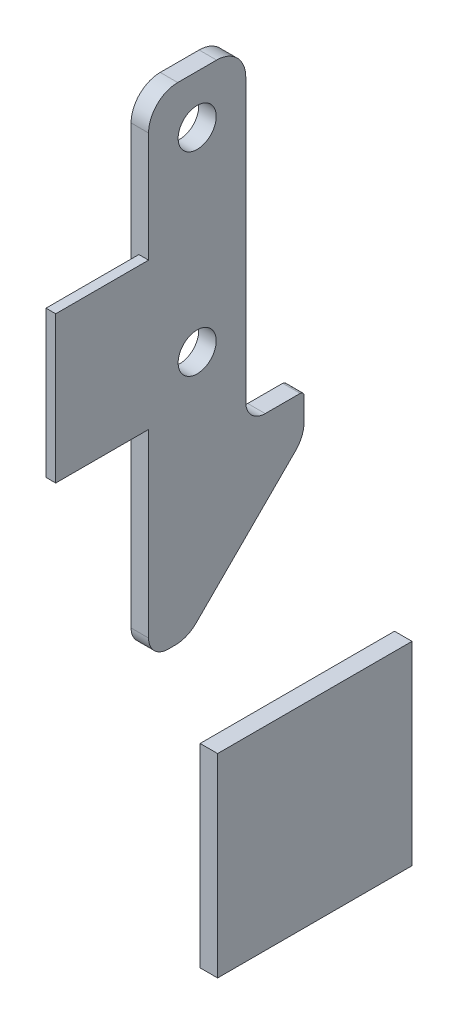
from build123d import *

# Parameters (mm, degrees)
SKETCH1_R           = 2.4892
BOSS_EXTRUDE1_DEPTH = 1.143
FILLET1_R           = 2.54
FILLET2_R           = 0.508
FILLET3_R           = 3.81
FILLET4_R           = 2.54
SKETCH4_W           = 25.4
SKETCH4_H           = 25.4
BOSS_EXTRUDE4_DEPTH = 2.286
SKETCH5_W           = 12.133155836
SKETCH5_H           = 19.15881217
BOSS_EXTRUDE5_DEPTH = 1.27


with BuildPart() as part:
    # Sketch1 → Boss-Extrude1 (new, symmetric)
    with BuildSketch(Plane(origin=(0, 0, 0), x_dir=(0, 0, -1), z_dir=(1, 0, 0))):
        Polygon((-6.35, -57.15), (-6.35, 6.35), (6.35, 6.35), (6.35, -36.83), (13.97, -36.83), (13.97, -41.91), (-1.27, -57.15), align=None)
        Circle(SKETCH1_R, mode=Mode.SUBTRACT)
        with Locations((0, -25.4)):
            Circle(SKETCH1_R, mode=Mode.SUBTRACT)
    extrude(amount=BOSS_EXTRUDE1_DEPTH, both=True)

    # Fillet1
    fillet1_edges = [part.edges().sort_by_distance(p)[0] for p in [
        (0, -36.83, -6.35),
    ]]
    fillet(fillet1_edges, radius=FILLET1_R)

    # Fillet2
    fillet2_edges = [part.edges().sort_by_distance(p)[0] for p in [
        (0, -36.83, -13.97),
    ]]
    fillet(fillet2_edges, radius=FILLET2_R)

    # Fillet3
    fillet3_edges = [part.edges().sort_by_distance(p)[0] for p in [
        (0, 6.35, -6.35),
        (0, -41.91, -13.97),
        (0, -57.15, 1.27),
        (0, 6.35, 6.35),
    ]]
    fillet(fillet3_edges, radius=FILLET3_R)

    # Fillet4
    fillet4_edges = [part.edges().sort_by_distance(p)[0] for p in [
        (0, -57.15, 6.35),
    ]]
    fillet(fillet4_edges, radius=FILLET4_R)

    # Sketch5 → Boss-Extrude5 (add)
    with BuildSketch(Plane(origin=(1.143, 0, 0), x_dir=(0, 0, -1), z_dir=(1, 0, 0))):
        with Locations((-12.416577918, -21.426514681)):
            Rectangle(SKETCH5_W, SKETCH5_H)
    extrude(amount=-BOSS_EXTRUDE5_DEPTH)


with BuildPart() as body_2:
    # Sketch4 → Boss-Extrude4 (new body)
    with BuildSketch(Plane(origin=(1.143, 0, 0), x_dir=(0, 0, -1), z_dir=(1, 0, 0))):
        with Locations((15.372144996, -84.89279632)):
            Rectangle(SKETCH4_W, SKETCH4_H)
    extrude(amount=-BOSS_EXTRUDE4_DEPTH)


solid = Compound([part.part, body_2.part])
